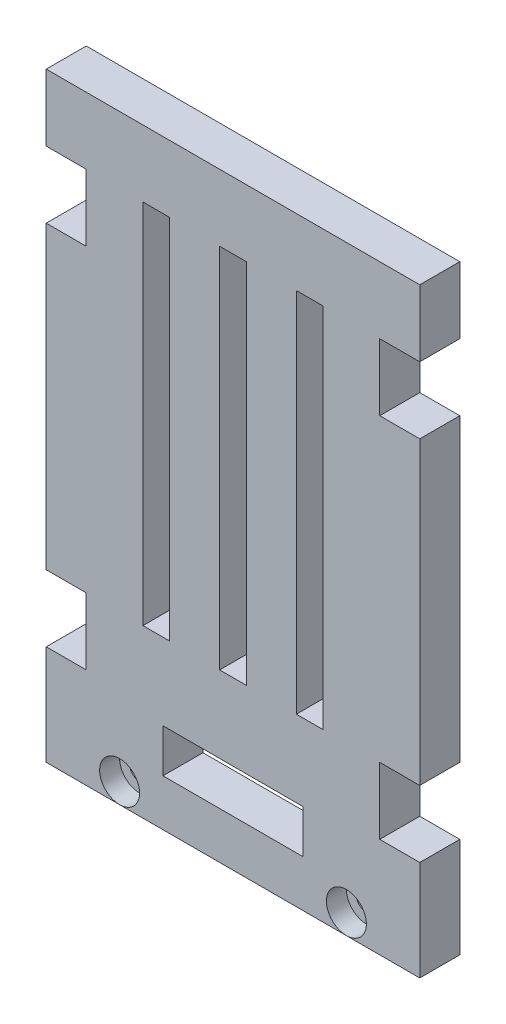
from build123d import *

# Parameters (mm, degrees)
ESQUISSE1_W             = 44
ESQUISSE1_H             = 90
BOSS_EXTRU_1_DEPTH      = 6
ESQUISSE2_W             = 21
ESQUISSE2_H             = 6.5
ESQUISSE2_W_2           = 4
ESQUISSE2_H_2           = 55
ENL_V_MAT_EXTRU_1_DEPTH = 6
ESQUISSE4_W             = 6
ESQUISSE4_H             = 10
ESQUISSE4_H_2           = 45
ESQUISSE4_H_3           = 15
BOSS_EXTRU_2_DEPTH      = 6
ESQUISSE6_R             = 1.5
ENL_V_MAT_EXTRU_3_DEPTH = 6
ESQUISSE8_R             = 2.995
ENL_V_MAT_EXTRU_4_DEPTH = 3


with BuildPart() as part:
    # Esquisse1 → Boss.-Extru.1 (new body)
    with BuildSketch(Plane.XY):
        with Locations((22, 45)):
            Rectangle(ESQUISSE1_W, ESQUISSE1_H)
    extrude(amount=BOSS_EXTRU_1_DEPTH)

    # Esquisse2 → Enlèv. mat.-Extru.1 (cut)
    with BuildSketch(Plane.XY.offset(6)):
        with Locations((22, 10.25)):
            Rectangle(ESQUISSE2_W, ESQUISSE2_H)
        with Locations((22, 52.5)):
            Rectangle(ESQUISSE2_W_2, ESQUISSE2_H_2)
        with Locations((33.5, 52.5)):
            Rectangle(ESQUISSE2_W_2, ESQUISSE2_H_2)
        with Locations((10.5, 52.5)):
            Rectangle(ESQUISSE2_W_2, ESQUISSE2_H_2)
    extrude(amount=-ENL_V_MAT_EXTRU_1_DEPTH, mode=Mode.SUBTRACT)

    # Esquisse4 → Boss.-Extru.2 (add)
    with BuildSketch(Plane.XY.offset(6)):
        with Locations((-3, 85)):
            Rectangle(ESQUISSE4_W, ESQUISSE4_H)
        with Locations((-3, 47.5)):
            Rectangle(ESQUISSE4_W, ESQUISSE4_H_2)
        with Locations((-3, 7.5)):
            Rectangle(ESQUISSE4_W, ESQUISSE4_H_3)
        with Locations((47, 7.5)):
            Rectangle(ESQUISSE4_W, ESQUISSE4_H_3)
        with Locations((47, 47.5)):
            Rectangle(ESQUISSE4_W, ESQUISSE4_H_2)
        with Locations((47, 85)):
            Rectangle(ESQUISSE4_W, ESQUISSE4_H)
    extrude(amount=-BOSS_EXTRU_2_DEPTH)

    # Esquisse6 → Enlèv. mat.-Extru.3 (cut)
    with BuildSketch(Plane.XY.offset(6)):
        with Locations((5, 3)):
            Circle(ESQUISSE6_R)
        with Locations((39, 3)):
            Circle(ESQUISSE6_R)
    extrude(amount=-ENL_V_MAT_EXTRU_3_DEPTH, mode=Mode.SUBTRACT)

    # Esquisse8 → Enlèv. mat.-Extru.4 (cut)
    with BuildSketch(Plane.XY.offset(6)):
        with Locations((5, 3)):
            Circle(ESQUISSE8_R)
        with Locations((39, 3)):
            Circle(ESQUISSE8_R)
    extrude(amount=-ENL_V_MAT_EXTRU_4_DEPTH, mode=Mode.SUBTRACT)


solid = part.part
